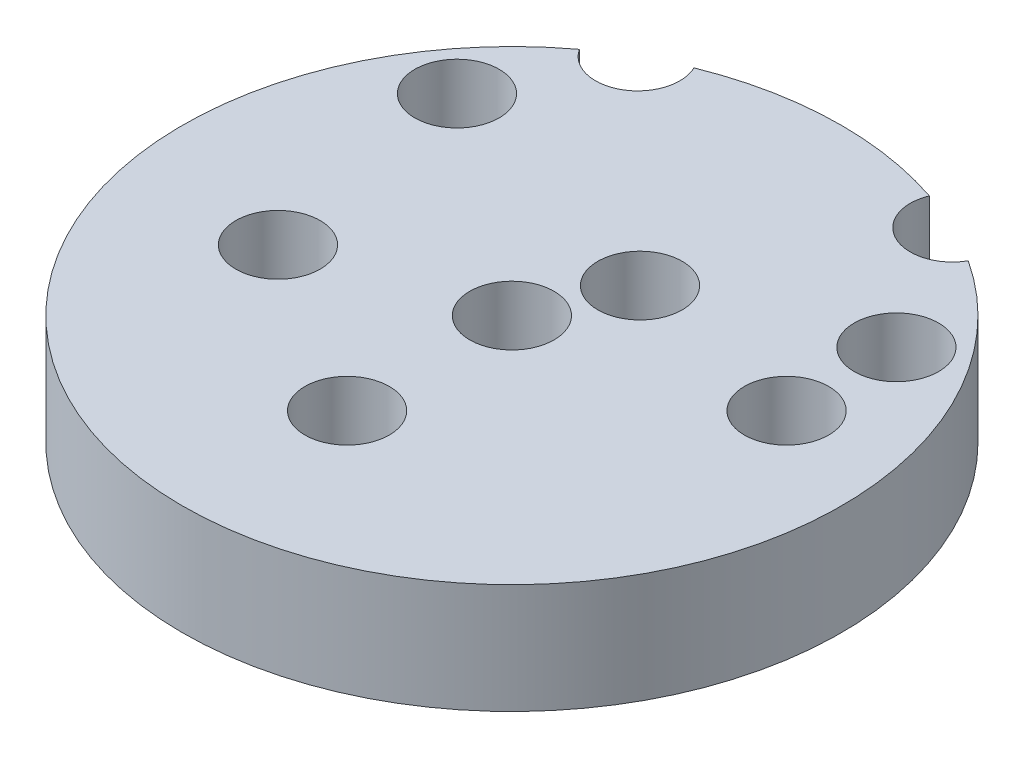
from build123d import *

# Parameters (mm, degrees)
SKETCH1_R              = 76.2
BOSS_EXTRUDE1_DEPTH    = 25.4
M22X2_5_TAPPED_HOLE1_D = 19.5


with BuildPart() as part:
    # Sketch1 → Boss-Extrude1 (new body)
    with BuildSketch(Plane(origin=(0, 0, 0), x_dir=(1, 0, 0), z_dir=(0, 1, 0))):
        with Locations(Location((0, 0, 0), (0, 0, 270))):
            Circle(SKETCH1_R)
    extrude(amount=-BOSS_EXTRUDE1_DEPTH)

    # M22x2.5 Tapped Hole1 (through all)
    with Locations(Plane(origin=(0, 0, 0), x_dir=(1, 0, 0), z_dir=(0, 1, 0))):
        with Locations((50.8, 12.7), (0, -38.1), (0, 0), (-50.8, 38.1), (50.8, 38.1), (-37.337291981, 66.425647362), (33.306888382, 68.535328016), (8.79976324, 20.818952057), (-41.20864737, -12.877702303)):
            Hole(M22X2_5_TAPPED_HOLE1_D / 2)


solid = part.part
